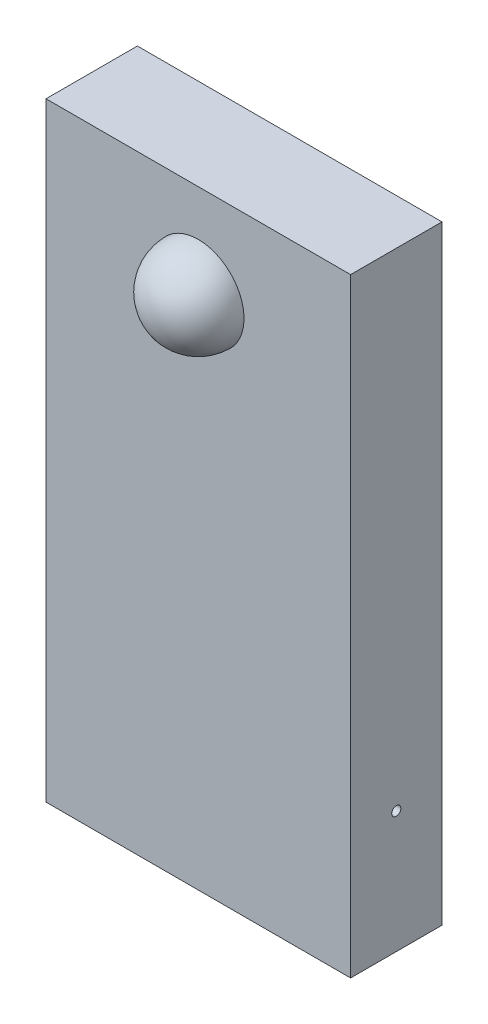
from build123d import *

# Parameters (mm, degrees)
SKETCH_1_W          = 100
SKETCH_1_H          = 30
EXTRUDE_1_DEPTH     = 200
SKETCH_3_R          = 1.5
CUT_EXTRUDE_1_DEPTH = 200


with BuildPart() as part:
    # 草圖1 → 填料-伸長1 (new body)
    with BuildSketch(Plane(origin=(0, 0, 0), x_dir=(1, 0, 0), z_dir=(0, 1, 0))):
        Rectangle(SKETCH_1_W, SKETCH_1_H)
    extrude(amount=EXTRUDE_1_DEPTH)

    # 草圖2 → 旋轉5 (revolve)
    with BuildSketch(Plane.XY.offset(15)):
        with BuildLine():
            Line((-15, 170), (15, 170))
            ThreePointArc((15, 170), (0, 185), (-15, 170))
        make_face()
    revolve(axis=Axis((-33.156754736, 170, 15), (1, 0, 0)))

    # 草圖3 → 除料-伸長1 (cut)
    with BuildSketch(Plane.ZY.offset(50)):
        with Locations((0, 40)):
            Circle(SKETCH_3_R)
    extrude(amount=-CUT_EXTRUDE_1_DEPTH, mode=Mode.SUBTRACT)


solid = part.part
